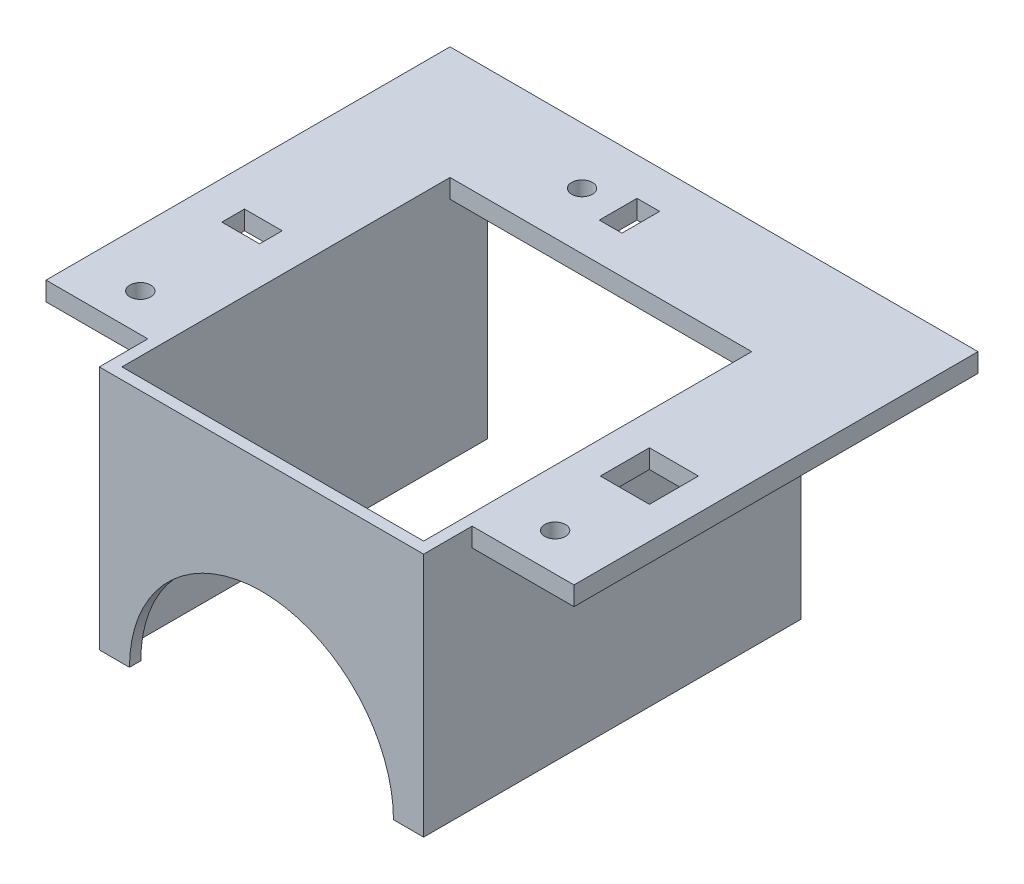
from build123d import *

# Parameters (mm, degrees)
BOSS_EXTRUDE1_DEPTH = 60
SKETCH2_W           = 30
SKETCH2_H           = 107.13499281
BOSS_EXTRUDE2_DEPTH = 5
SKETCH3_W           = 80
SKETCH3_H           = 30
BOSS_EXTRUDE3_DEPTH = 5
BOSS_EXTRUDE4_DEPTH = 5
CUT_EXTRUDE2_DEPTH  = 5
SKETCH7_R           = 2.75
CUT_EXTRUDE3_DEPTH  = 178.183520676
SKETCH8_W           = 10
SKETCH8_H           = 6
SKETCH8_W_2         = 6
SKETCH8_H_2         = 10
CUT_EXTRUDE4_DEPTH  = 178.183520676
SKETCH10_W          = 13
SKETCH10_H          = 13
CUT_EXTRUDE5_DEPTH  = 178.183520676


with BuildPart() as part:
    # Sketch1 → Boss-Extrude1 (new body)
    with BuildSketch(Plane(origin=(0, 0, 0), x_dir=(1, 0, 0), z_dir=(0, 1, 0))):
        Polygon((0, 0), (0, 100), (3, 100), (3, 3), (83, 3), (83, 100), (86, 100), (86, 0), align=None)
    extrude(amount=BOSS_EXTRUDE1_DEPTH)

    # Sketch2 → Boss-Extrude2 (add)
    with BuildSketch(Plane(origin=(0, 60, 0), x_dir=(1, 0, 0), z_dir=(0, 1, 0))):
        with Locations((98, 66.432503591)):
            Rectangle(SKETCH2_W, SKETCH2_H)
        with Locations((-12, 66.432503591)):
            Rectangle(SKETCH2_W, SKETCH2_H)
    extrude(amount=BOSS_EXTRUDE2_DEPTH)

    # Sketch3 → Boss-Extrude3 (add)
    with BuildSketch(Plane(origin=(0, 65, 0), x_dir=(1, 0, 0), z_dir=(0, 1, 0))):
        with Locations((43, 104.999999996)):
            Rectangle(SKETCH3_W, SKETCH3_H)
    extrude(amount=-BOSS_EXTRUDE3_DEPTH)

    # Sketch5 → Boss-Extrude4 (add)
    with BuildSketch(Plane(origin=(0, 60, 0), x_dir=(1, 0, 0), z_dir=(0, 1, 0))):
        Polygon((0, 12.865007186), (0, 0), (86, 0), (86, 12.865007186), (83, 12.865007186), (83, 3), (3, 3), (3, 12.865007186), align=None)
    extrude(amount=BOSS_EXTRUDE4_DEPTH)

    # Sketch6 → Cut-Extrude2 (cut)
    with BuildSketch(Plane.XY):
        with BuildLine():
            Line((8, 0), (78, 0))
            ThreePointArc((78, 0), (43, 35), (8, 0))
        make_face()
    extrude(amount=-CUT_EXTRUDE2_DEPTH, mode=Mode.SUBTRACT)

    # Sketch7 → Cut-Extrude3 (cut, through all)
    with BuildSketch(Plane(origin=(0, 65, 0), x_dir=(1, 0, 0), z_dir=(0, 1, 0))):
        with Locations(Location((-12, 22.865007186, 0), (0, 0, 270))):
            Circle(SKETCH7_R)
        with Locations(Location((23, 104.999999996, 0), (0, 0, 270))):
            Circle(SKETCH7_R)
        with Locations(Location((98, 22.865007186, 0), (0, 0, 270))):
            Circle(SKETCH7_R)
    extrude(amount=-CUT_EXTRUDE3_DEPTH, mode=Mode.SUBTRACT)

    # Sketch8 → Cut-Extrude4 (cut, through all)
    with BuildSketch(Plane(origin=(0, 65, 0), x_dir=(1, 0, 0), z_dir=(0, 1, 0))):
        with Locations((-12, 52.499999996)):
            Rectangle(SKETCH8_W, SKETCH8_H)
        with Locations((35.581142125, 104.999999996)):
            Rectangle(SKETCH8_W_2, SKETCH8_H_2)
    extrude(amount=-CUT_EXTRUDE4_DEPTH, mode=Mode.SUBTRACT)

    # Sketch10 → Cut-Extrude5 (cut, through all)
    with BuildSketch(Plane(origin=(0, 65, 0), x_dir=(1, 0, 0), z_dir=(0, 1, 0))):
        with Locations((98, 47.865007186)):
            Rectangle(SKETCH10_W, SKETCH10_H)
    extrude(amount=-CUT_EXTRUDE5_DEPTH, mode=Mode.SUBTRACT)


solid = part.part
